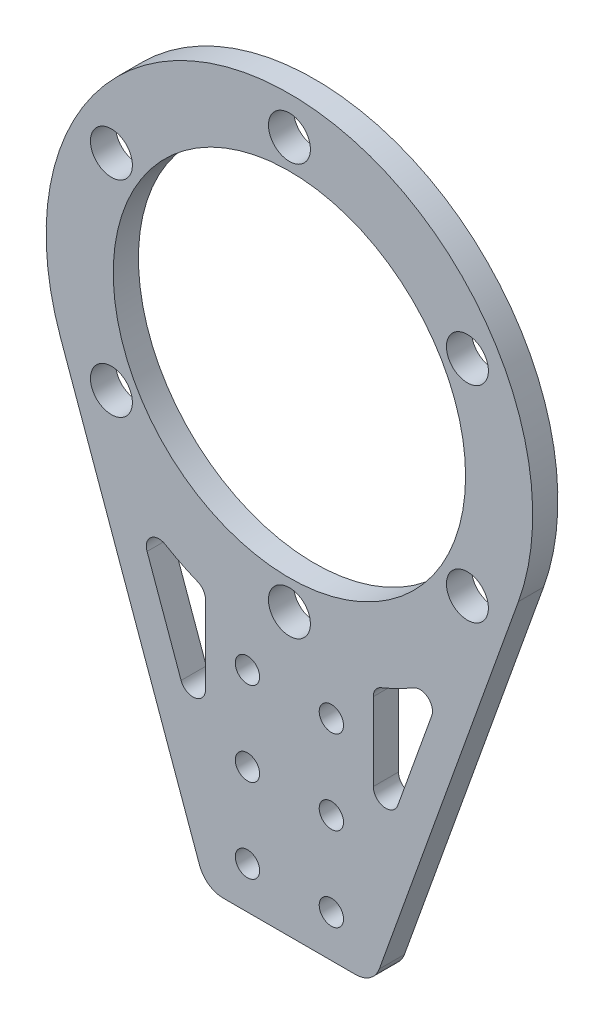
from build123d import *

# Parameters (mm, degrees)
SKETCH_2_R          = 21
SKETCH_2_R_2        = 2.5
EXTRUDE_1_DEPTH     = 3
FILLET_1_R          = 1.5
SKETCH_3_R          = 1.45
CUT_EXTRUDE_1_DEPTH = 5
FILLET_2_R          = 3


with BuildPart() as part:
    # 草图2 → 凸台-拉伸1 (new body)
    with BuildSketch(Plane.XY):
        with BuildLine():
            Line((-10, -58), (10, -58))
            Line((10, -58), (27.296195268, -9.793759437))
            ThreePointArc((27.296195268, -9.793759437), (0, 29), (-27.296195268, -9.793759437))
            Line((-27.296195268, -9.793759437), (-10, -58))
        make_face()
        Circle(SKETCH_2_R, mode=Mode.SUBTRACT)
        with Locations((0, 24.5)):
            Circle(SKETCH_2_R_2, mode=Mode.SUBTRACT)
        with Locations((21.217622393, 12.25)):
            Circle(SKETCH_2_R_2, mode=Mode.SUBTRACT)
        with Locations((21.217622393, -12.25)):
            Circle(SKETCH_2_R_2, mode=Mode.SUBTRACT)
        with Locations((0, -24.5)):
            Circle(SKETCH_2_R_2, mode=Mode.SUBTRACT)
        with Locations((-21.217622393, -12.25)):
            Circle(SKETCH_2_R_2, mode=Mode.SUBTRACT)
        with Locations((-21.217622393, 12.25)):
            Circle(SKETCH_2_R_2, mode=Mode.SUBTRACT)
        with BuildLine():
            Line((-10, -46.155722963), (-10, -27.221315178))
            ThreePointArc((-10, -27.221315178), (-14.496314654, -25.116864085), (-18.567813862, -22.276361651))
            Line((-18.567813862, -22.276361651), (-10, -46.155722963))
        make_face(mode=Mode.SUBTRACT)
        with BuildLine():
            Line((10, -46.155722963), (10, -27.221315178))
            ThreePointArc((10, -27.221315178), (14.496314654, -25.116864085), (18.567813862, -22.276361651))
            Line((18.567813862, -22.276361651), (10, -46.155722963))
        make_face(mode=Mode.SUBTRACT)
    extrude(amount=EXTRUDE_1_DEPTH)

    # 圆角1
    fillet_1_edges = [part.edges().sort_by_distance(p)[0] for p in [
        (18.567813862, -22.276361651, 1.5),
        (10, -46.155722963, 1.5),
        (10, -27.221315178, 1.5),
        (-10, -46.155722963, 1.5),
        (-18.567813862, -22.276361651, 1.5),
        (-10, -27.221315178, 1.5),
    ]]
    fillet(fillet_1_edges, radius=FILLET_1_R)

    # 草图3 → 切除-拉伸1 (cut)
    with BuildSketch(Plane(origin=(0, 0, 0), x_dir=(-1, 0, 0), z_dir=(0, 0, -1))):
        with Locations((-5, -33)):
            Circle(SKETCH_3_R)
        with Locations((-5, -43)):
            Circle(SKETCH_3_R)
        with Locations((-5, -53)):
            Circle(SKETCH_3_R)
        with Locations((5, -53)):
            Circle(SKETCH_3_R)
        with Locations((5, -43)):
            Circle(SKETCH_3_R)
        with Locations((5, -33)):
            Circle(SKETCH_3_R)
    extrude(amount=-CUT_EXTRUDE_1_DEPTH, mode=Mode.SUBTRACT)

    # 圆角2
    fillet_2_edges = [part.edges().sort_by_distance(p)[0] for p in [
        (-10, -58, 1.5),
        (10, -58, 1.5),
    ]]
    fillet(fillet_2_edges, radius=FILLET_2_R)


solid = part.part
